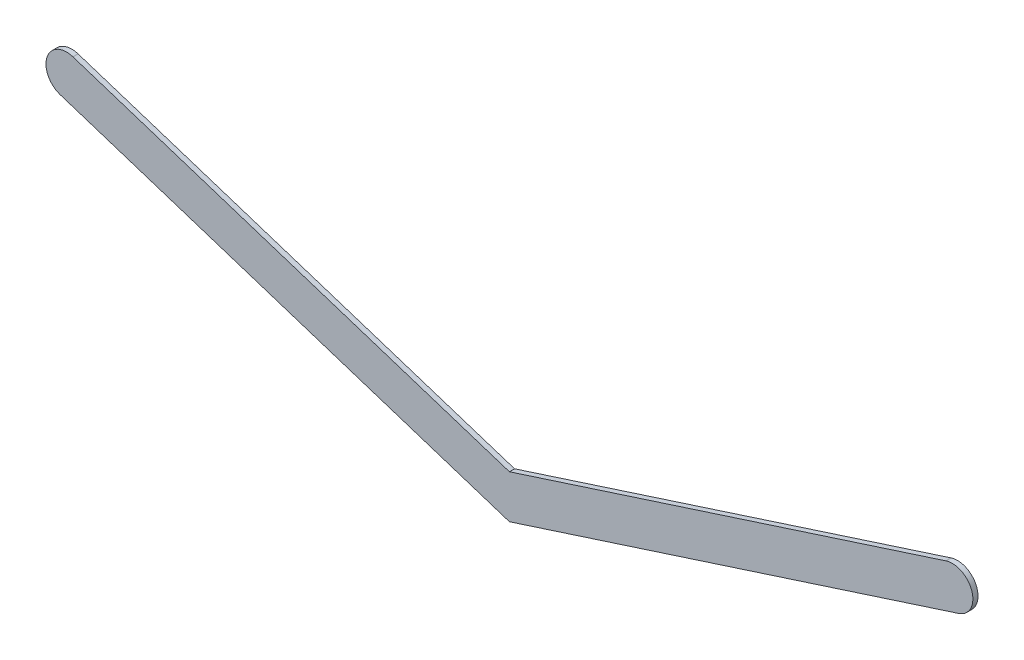
from build123d import *

# Parameters (mm, degrees)
BOSS_EXTRUDE1_DEPTH = 3.175


with BuildPart() as part:
    # Sketch1 → Boss-Extrude1 (new, symmetric)
    with BuildSketch(Plane.XY):
        with BuildLine():
            Line((-553.911696572, -24.168934537), (0, -203.2))
            Line((0, -203.2), (553.911696572, -24.168934537))
            ThreePointArc((553.911696572, -24.168934537), (570.268934537, 7.811696572), (538.288303428, 24.168934537))
            Line((538.288303428, 24.168934537), (0, -149.812458319))
            Line((0, -149.812458319), (-538.288303428, 24.168934537))
            ThreePointArc((-538.288303428, 24.168934537), (-570.268934537, 7.811696572), (-553.911696572, -24.168934537))
        make_face()
    extrude(amount=BOSS_EXTRUDE1_DEPTH, both=True)


solid = part.part
